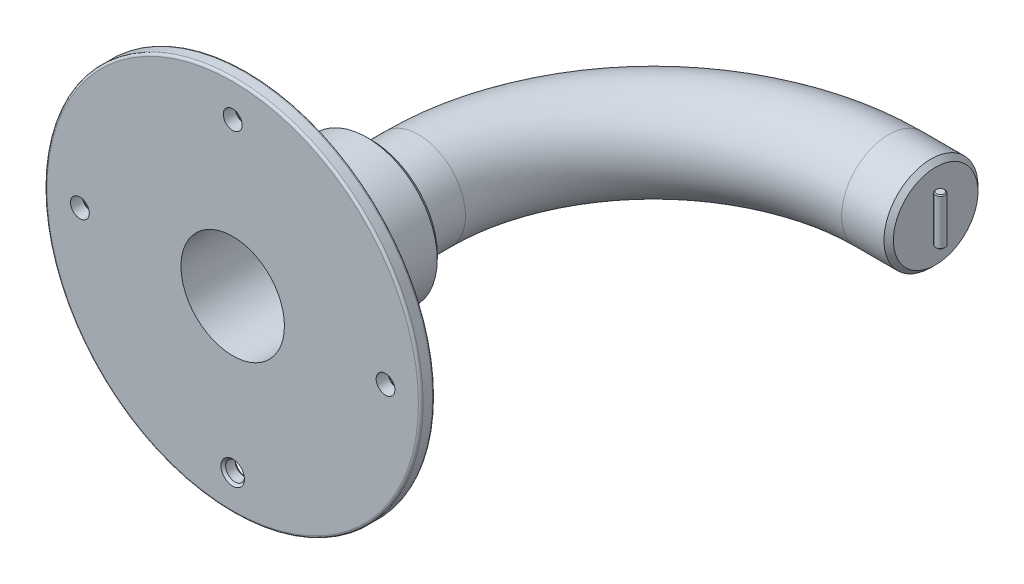
from build123d import *

# Parameters (mm, degrees)
SKETCH1_R           = 15
BOSS_EXTRUDE1_DEPTH = 29.5
SKETCH2_R           = 40
BOSS_EXTRUDE2_DEPTH = 3
CHAMFER1_SIZE       = 1
SKETCH3_R           = 11
CUT_EXTRUDE1_DEPTH  = 26
FILLET1_R           = 0.5
SKETCH4_R           = 2
CUT_EXTRUDE2_DEPTH  = 26
CIRPATTERN1_COUNT   = 4
CHAMFER2_SIZE       = 0.5
SKETCH6_R           = 10
CHAMFER3_SIZE       = 1
SKETCH7_R           = 1
BOSS_EXTRUDE3_DEPTH = 5
CHAMFER4_SIZE       = 0.2


with BuildPart() as part:
    # Sketch1 → Boss-Extrude1 (new body)
    with BuildSketch(Plane.XY):
        Circle(SKETCH1_R)
    extrude(amount=BOSS_EXTRUDE1_DEPTH)

    # Sketch2 → Boss-Extrude2 (add)
    with BuildSketch(Plane.XY.offset(29.5)):
        Circle(SKETCH2_R)
    extrude(amount=-BOSS_EXTRUDE2_DEPTH)

    # Chamfer1
    chamfer1_edges = [part.edges().sort_by_distance(p)[0] for p in [
        (-15, 0, 0),
        (-15, 0, 26.5),
    ]]
    chamfer(chamfer1_edges, length=CHAMFER1_SIZE)

    # Sketch3 → Cut-Extrude1 (cut)
    with BuildSketch(Plane.XY.offset(29.5)):
        Circle(SKETCH3_R)
    extrude(amount=-CUT_EXTRUDE1_DEPTH, mode=Mode.SUBTRACT)

    # Fillet1
    fillet1_edges = [part.edges().sort_by_distance(p)[0] for p in [
        (-40, 0, 26.5),
        (-40, 0, 29.5),
    ]]
    fillet(fillet1_edges, radius=FILLET1_R)

    # Sketch4 → Cut-Extrude2 (cut)
    with BuildSketch(Plane(origin=(0, 0, 26.5), x_dir=(-1, 0, 0), z_dir=(0, 0, -1))):
        with Locations((0, 32.5)):
            Circle(SKETCH4_R)
    cut_extrude2 = extrude(amount=-CUT_EXTRUDE2_DEPTH, mode=Mode.SUBTRACT)

    # CirPattern1: Cut-Extrude2 ×4 about axis
    cirpattern1_axis = Axis((0, 0, 0), (0, 0, 1))
    for i in range(1, CIRPATTERN1_COUNT):
        add(cut_extrude2.rotate(cirpattern1_axis, i * 360 / CIRPATTERN1_COUNT), mode=Mode.SUBTRACT)

    # Chamfer2
    chamfer2_edges = [part.edges().sort_by_distance(p)[0] for p in [
        (2, 32.5, 26.5),
        (32.5, -2, 26.5),
        (-2, -32.5, 29.5),
        (-2, -32.5, 26.5),
        (-32.5, 2, 26.5),
    ]]
    chamfer(chamfer2_edges, length=CHAMFER2_SIZE)

    # Sweep1: sweep along a path in Sketch5
    with BuildLine(Plane(origin=(0, 0, 0), x_dir=(1, 0, 0), z_dir=(0, 1, 0))) as sweep1_path:
        Line((0, 0), (0, 10))
        ThreePointArc((0, 10), (14.644660941, 45.355339059), (50, 60))
        Line((50, 60), (60, 60))
    # Sketch6 → Sweep1 (sweep)
    with BuildSketch(Plane(origin=(0, 0, 0), x_dir=(-1, 0, 0), z_dir=(0, 0, -1))):
        Circle(SKETCH6_R)
    sweep(path=sweep1_path.line)

    # Chamfer3
    chamfer3_edges = [part.edges().sort_by_distance(p)[0] for p in [
        (60, 0, -50),
    ]]
    chamfer(chamfer3_edges, length=CHAMFER3_SIZE)


with BuildPart() as body_2:
    # Sketch7 → Boss-Extrude3 (new, symmetric)
    with BuildSketch(Plane.XZ):
        with Locations(Location((61, -60, 0), (0, 0, 270))):
            Circle(SKETCH7_R)
    extrude(amount=BOSS_EXTRUDE3_DEPTH, both=True)

    # Chamfer4
    chamfer4_edges = [body_2.edges().sort_by_distance(p)[0] for p in [
        (61, 5, -59),
        (61, -5, -59),
    ]]
    chamfer(chamfer4_edges, length=CHAMFER4_SIZE)


solid = Compound([part.part, body_2.part])
